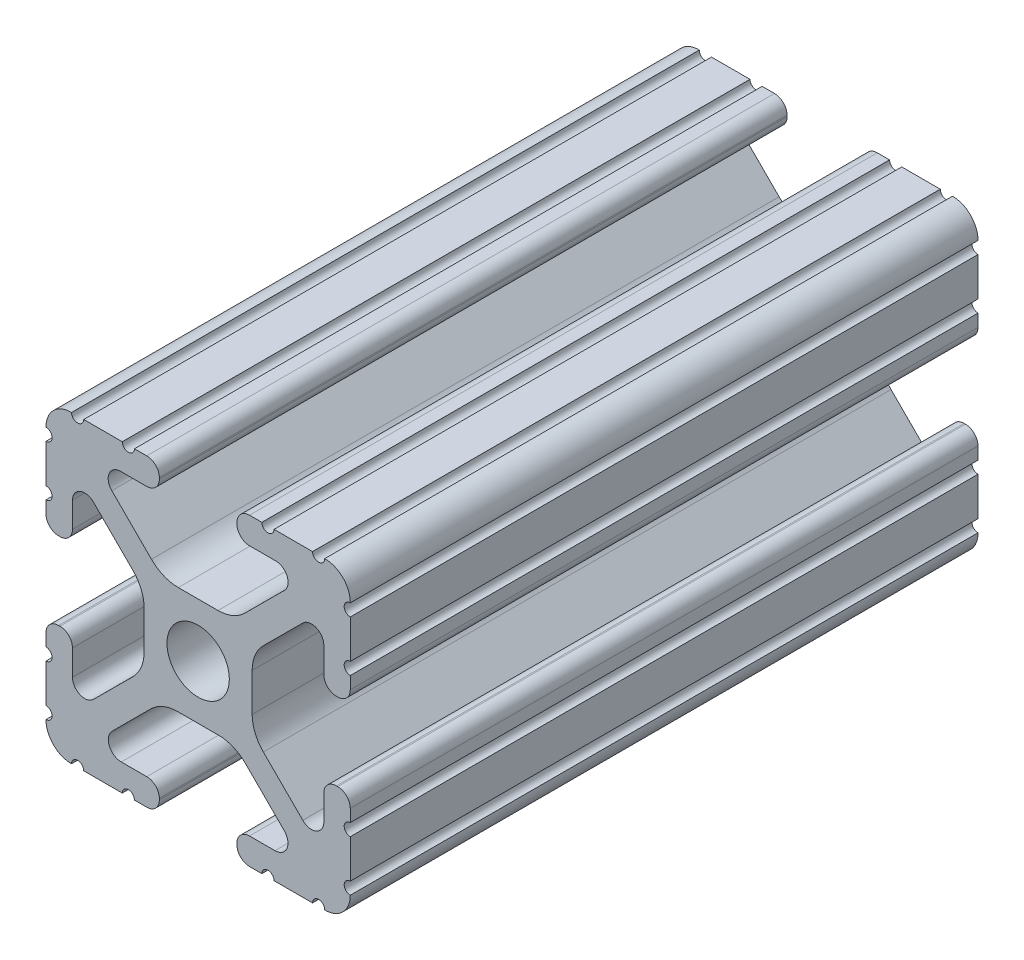
from build123d import *

# Parameters (mm, degrees)
SKETCH1_R           = 2.6035
BOSS_EXTRUDE1_DEPTH = 26.2


with BuildPart() as part:
    # Sketch1 → Boss-Extrude1 (new, symmetric)
    with BuildSketch(Plane.XY):
        with BuildLine():
            Line((-7.179650497, -8.645192506), (-3.952270251, -5.423690499))
            ThreePointArc((-3.952270251, -5.423690499), (-2.922936451, -4.736929036), (-1.709253557, -4.4958))
            Line((-1.709253557, -4.4958), (1.709253557, -4.4958))
            ThreePointArc((1.709253557, -4.4958), (2.922936451, -4.736929036), (3.952270251, -5.423690499))
            Line((3.952270251, -5.423690499), (7.179650497, -8.645192506))
            ThreePointArc((7.179650497, -8.645192506), (7.41473083, -9.822813117), (6.416408329, -10.4902))
            Line((6.416408329, -10.4902), (4.287512407, -10.4902))
            ThreePointArc((4.287512407, -10.4902), (3.54574862, -10.79744862), (3.2385, -11.539212407))
            Line((3.2385, -11.539212407), (3.2385, -11.650987593))
            ThreePointArc((3.2385, -11.650987593), (3.54574862, -12.39275138), (4.287512407, -12.7))
            Line((4.287512407, -12.7), (5.317126718, -12.7))
            ThreePointArc((5.317126718, -12.7), (5.825126718, -12.192), (6.333126718, -12.7))
            Line((6.333126718, -12.7), (9.550443118, -12.7))
            ThreePointArc((9.550443118, -12.7), (10.058366869, -12.192000006), (10.566443095, -12.699847501))
            ThreePointArc((10.566443095, -12.699847501), (12.082537762, -12.08250727), (12.699846982, -10.566399977))
            ThreePointArc((12.699846982, -10.566399977), (12.192000006, -10.058323491), (12.7, -9.5504))
            Line((12.7, -9.5504), (12.7, -6.3330836))
            ThreePointArc((12.7, -6.3330836), (12.192, -5.8250836), (12.7, -5.3170836))
            Line((12.7, -5.3170836), (12.7, -4.287469289))
            ThreePointArc((12.7, -4.287469289), (12.39275138, -3.545705502), (11.650987593, -3.238456882))
            Line((11.650987593, -3.238456882), (11.539212407, -3.238456882))
            ThreePointArc((11.539212407, -3.238456882), (10.79744862, -3.545705502), (10.4902, -4.287469289))
            Line((10.4902, -4.287469289), (10.4902, -6.402089023))
            ThreePointArc((10.4902, -6.402089023), (9.856505071, -7.351067942), (8.737131347, -7.129408934))
            Line((8.737131347, -7.129408934), (5.441005833, -3.840816462))
            ThreePointArc((5.441005833, -3.840816462), (4.750877967, -2.809883091), (4.5085, -1.593185507))
            Line((4.5085, -1.593185507), (4.5085, 1.593185507))
            ThreePointArc((4.5085, 1.593185507), (4.750877967, 2.809883091), (5.441005833, 3.840816462))
            Line((5.441005833, 3.840816462), (8.737131347, 7.129408934))
            ThreePointArc((8.737131347, 7.129408934), (9.856505071, 7.351067942), (10.4902, 6.402089023))
            Line((10.4902, 6.402089023), (10.4902, 4.287469289))
            ThreePointArc((10.4902, 4.287469289), (10.79744862, 3.545705502), (11.539212407, 3.238456882))
            Line((11.539212407, 3.238456882), (11.650987593, 3.238456882))
            ThreePointArc((11.650987593, 3.238456882), (12.39275138, 3.545705502), (12.7, 4.287469289))
            Line((12.7, 4.287469289), (12.7, 5.3170836))
            ThreePointArc((12.7, 5.3170836), (12.192, 5.8250836), (12.7, 6.3330836))
            Line((12.7, 6.3330836), (12.7, 9.5504))
            ThreePointArc((12.7, 9.5504), (12.192000006, 10.058323491), (12.699846982, 10.566399977))
            ThreePointArc((12.699846982, 10.566399977), (12.082537762, 12.08250727), (10.566443095, 12.699847501))
            ThreePointArc((10.566443095, 12.699847501), (10.058366869, 12.192000006), (9.550443118, 12.7))
            Line((9.550443118, 12.7), (6.333126718, 12.7))
            ThreePointArc((6.333126718, 12.7), (5.825126718, 12.192), (5.317126718, 12.7))
            Line((5.317126718, 12.7), (4.287512407, 12.7))
            ThreePointArc((4.287512407, 12.7), (3.54574862, 12.39275138), (3.2385, 11.650987593))
            Line((3.2385, 11.650987593), (3.2385, 11.539212407))
            ThreePointArc((3.2385, 11.539212407), (3.54574862, 10.79744862), (4.287512407, 10.4902))
            Line((4.287512407, 10.4902), (6.476788598, 10.4902))
            ThreePointArc((6.476788598, 10.4902), (7.432222385, 9.85140422), (7.207036008, 8.724370562))
            Line((7.207036008, 8.724370562), (3.898272566, 5.423169045))
            ThreePointArc((3.898272566, 5.423169045), (2.869120213, 4.736787962), (1.655778399, 4.4958))
            Line((1.655778399, 4.4958), (-1.655778399, 4.4958))
            ThreePointArc((-1.655778399, 4.4958), (-2.869120213, 4.736787962), (-3.898272566, 5.423169045))
            Line((-3.898272566, 5.423169045), (-7.207036008, 8.724370562))
            ThreePointArc((-7.207036008, 8.724370562), (-7.432222385, 9.85140422), (-6.476788598, 10.4902))
            Line((-6.476788598, 10.4902), (-4.287512407, 10.4902))
            ThreePointArc((-4.287512407, 10.4902), (-3.54574862, 10.79744862), (-3.2385, 11.539212407))
            Line((-3.2385, 11.539212407), (-3.2385, 11.650987593))
            ThreePointArc((-3.2385, 11.650987593), (-3.54574862, 12.39275138), (-4.287512407, 12.7))
            Line((-4.287512407, 12.7), (-5.317126718, 12.7))
            ThreePointArc((-5.317126718, 12.7), (-5.825126718, 12.192), (-6.333126718, 12.7))
            Line((-6.333126718, 12.7), (-9.550443118, 12.7))
            ThreePointArc((-9.550443118, 12.7), (-10.058366869, 12.192000006), (-10.566443095, 12.699847501))
            ThreePointArc((-10.566443095, 12.699847501), (-12.082537762, 12.08250727), (-12.699846982, 10.566399977))
            ThreePointArc((-12.699846982, 10.566399977), (-12.192000006, 10.058323491), (-12.7, 9.5504))
            Line((-12.7, 9.5504), (-12.7, 6.3330836))
            ThreePointArc((-12.7, 6.3330836), (-12.192, 5.8250836), (-12.7, 5.3170836))
            Line((-12.7, 5.3170836), (-12.7, 4.287469289))
            ThreePointArc((-12.7, 4.287469289), (-12.39275138, 3.545705502), (-11.650987593, 3.238456882))
            Line((-11.650987593, 3.238456882), (-11.539212407, 3.238456882))
            ThreePointArc((-11.539212407, 3.238456882), (-10.79744862, 3.545705502), (-10.4902, 4.287469289))
            Line((-10.4902, 4.287469289), (-10.4902, 6.402089023))
            ThreePointArc((-10.4902, 6.402089023), (-9.856505071, 7.351067942), (-8.737131347, 7.129408934))
            Line((-8.737131347, 7.129408934), (-5.441005833, 3.840816462))
            ThreePointArc((-5.441005833, 3.840816462), (-4.750877967, 2.809883091), (-4.5085, 1.593185507))
            Line((-4.5085, 1.593185507), (-4.5085, -1.593185507))
            ThreePointArc((-4.5085, -1.593185507), (-4.750877967, -2.809883091), (-5.441005833, -3.840816462))
            Line((-5.441005833, -3.840816462), (-8.737131347, -7.129408934))
            ThreePointArc((-8.737131347, -7.129408934), (-9.856505071, -7.351067942), (-10.4902, -6.402089023))
            Line((-10.4902, -6.402089023), (-10.4902, -4.287469289))
            ThreePointArc((-10.4902, -4.287469289), (-10.79744862, -3.545705502), (-11.539212407, -3.238456882))
            Line((-11.539212407, -3.238456882), (-11.650987593, -3.238456882))
            ThreePointArc((-11.650987593, -3.238456882), (-12.39275138, -3.545705502), (-12.7, -4.287469289))
            Line((-12.7, -4.287469289), (-12.7, -5.3170836))
            ThreePointArc((-12.7, -5.3170836), (-12.192, -5.8250836), (-12.7, -6.3330836))
            Line((-12.7, -6.3330836), (-12.7, -9.5504))
            ThreePointArc((-12.7, -9.5504), (-12.192000006, -10.058323491), (-12.699846982, -10.566399977))
            ThreePointArc((-12.699846982, -10.566399977), (-12.082537762, -12.08250727), (-10.566443095, -12.699847501))
            ThreePointArc((-10.566443095, -12.699847501), (-10.058366869, -12.192000006), (-9.550443118, -12.7))
            Line((-9.550443118, -12.7), (-6.333126718, -12.7))
            ThreePointArc((-6.333126718, -12.7), (-5.825126718, -12.192), (-5.317126718, -12.7))
            Line((-5.317126718, -12.7), (-4.287512407, -12.7))
            ThreePointArc((-4.287512407, -12.7), (-3.54574862, -12.39275138), (-3.2385, -11.650987593))
            Line((-3.2385, -11.650987593), (-3.2385, -11.539212407))
            ThreePointArc((-3.2385, -11.539212407), (-3.54574862, -10.79744862), (-4.287512407, -10.4902))
            Line((-4.287512407, -10.4902), (-6.416408329, -10.4902))
            ThreePointArc((-6.416408329, -10.4902), (-7.41473083, -9.822813117), (-7.179650497, -8.645192506))
        make_face()
        Circle(SKETCH1_R, mode=Mode.SUBTRACT)
    extrude(amount=BOSS_EXTRUDE1_DEPTH, both=True)


solid = part.part
